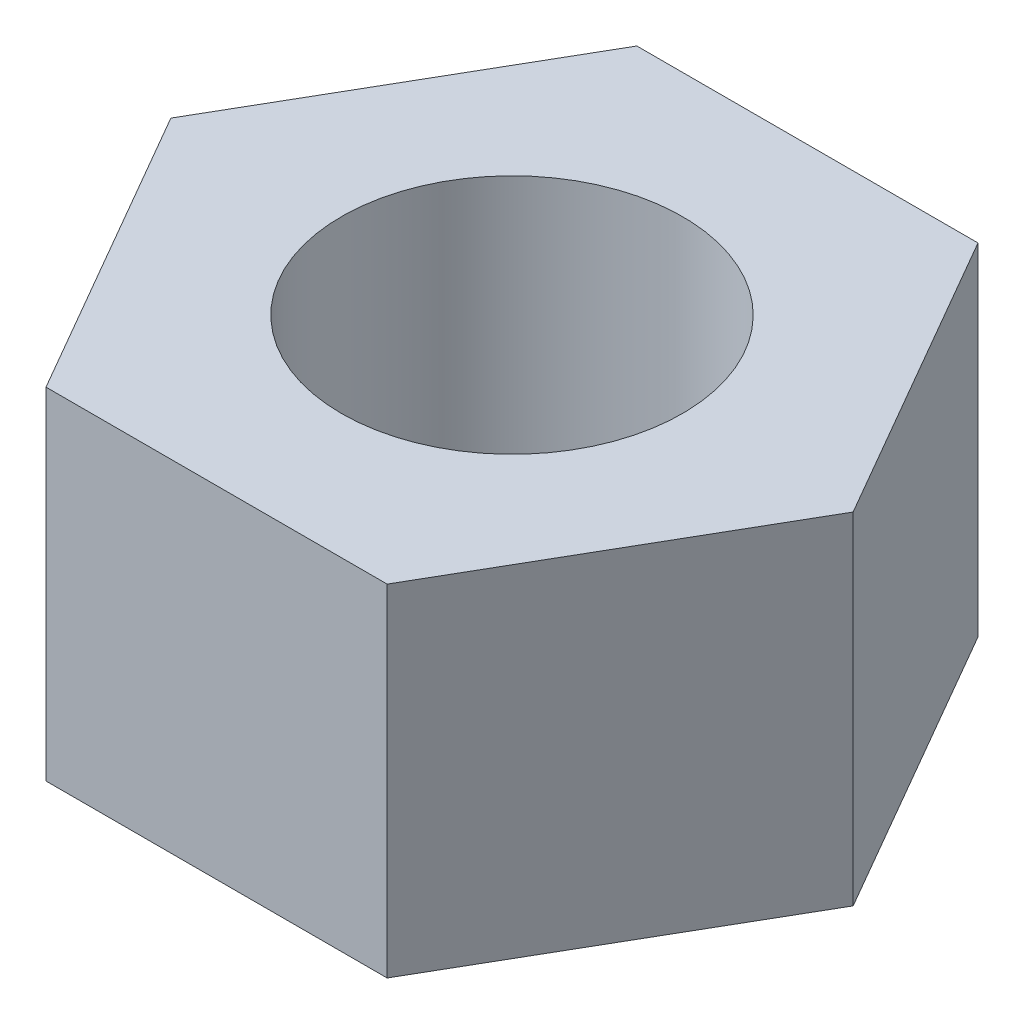
from build123d import *

# Parameters (mm, degrees)
ESQUISSE1_R        = 10
BOSS_EXTRU_1_DEPTH = 20


with BuildPart() as part:
    # Esquisse1 → Boss.-Extru.1 (new body)
    with BuildSketch(Plane(origin=(0, 0, 0), x_dir=(1, 0, 0), z_dir=(0, 1, 0))):
        Polygon((-10, 17.320508076), (10, 17.320508076), (20, 0), (10, -17.320508076), (-10, -17.320508076), (-20, 0), align=None)
        with Locations(Location((0, 0, 0), (0, 0, 270))):
            Circle(ESQUISSE1_R, mode=Mode.SUBTRACT)
    extrude(amount=BOSS_EXTRU_1_DEPTH)


solid = part.part
